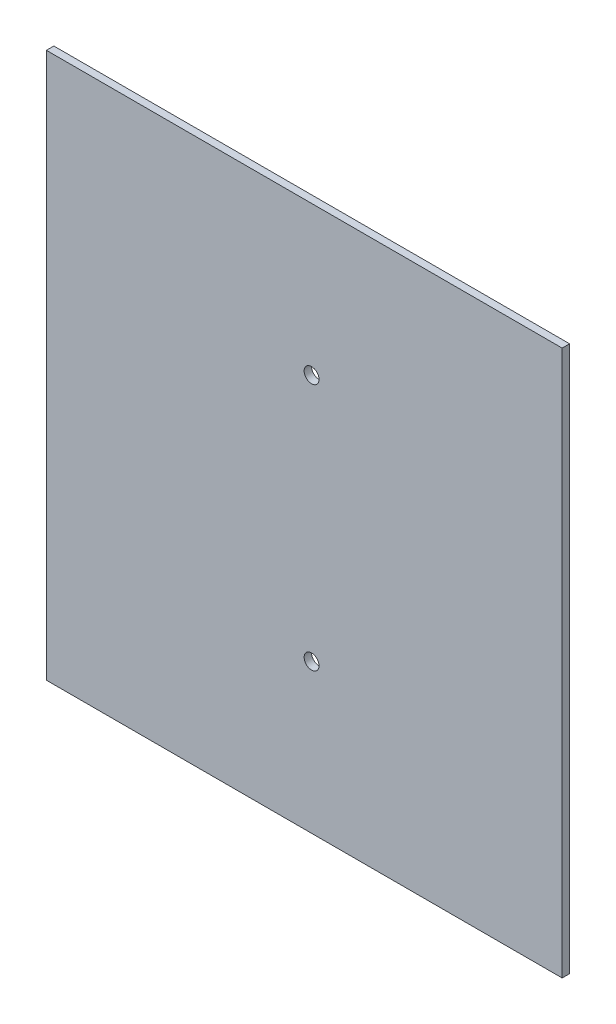
from build123d import *

# Parameters (mm, degrees)
SKETCH2_W             = 104
SKETCH2_H             = 110
BOSS_EXTRUDE1_DEPTH   = 1.5
F_3_0MM_DOWEL_HOLE2_D = 3


with BuildPart() as part:
    # Sketch2 → Boss-Extrude1 (new body)
    with BuildSketch(Plane.XY):
        with Locations((52, 55)):
            Rectangle(SKETCH2_W, SKETCH2_H)
    extrude(amount=BOSS_EXTRUDE1_DEPTH)

    # Ø3.0mm Dowel Hole2 (through all)
    with Locations(Plane(origin=(34.234146321, -1.119987894, -1.5), x_dir=(-1, 0, 0), z_dir=(0, 0, -1))):
        with Locations((-19.237938753, 81.119987894), (-19.237938753, 31.119987894)):
            Hole(F_3_0MM_DOWEL_HOLE2_D / 2)


solid = part.part
